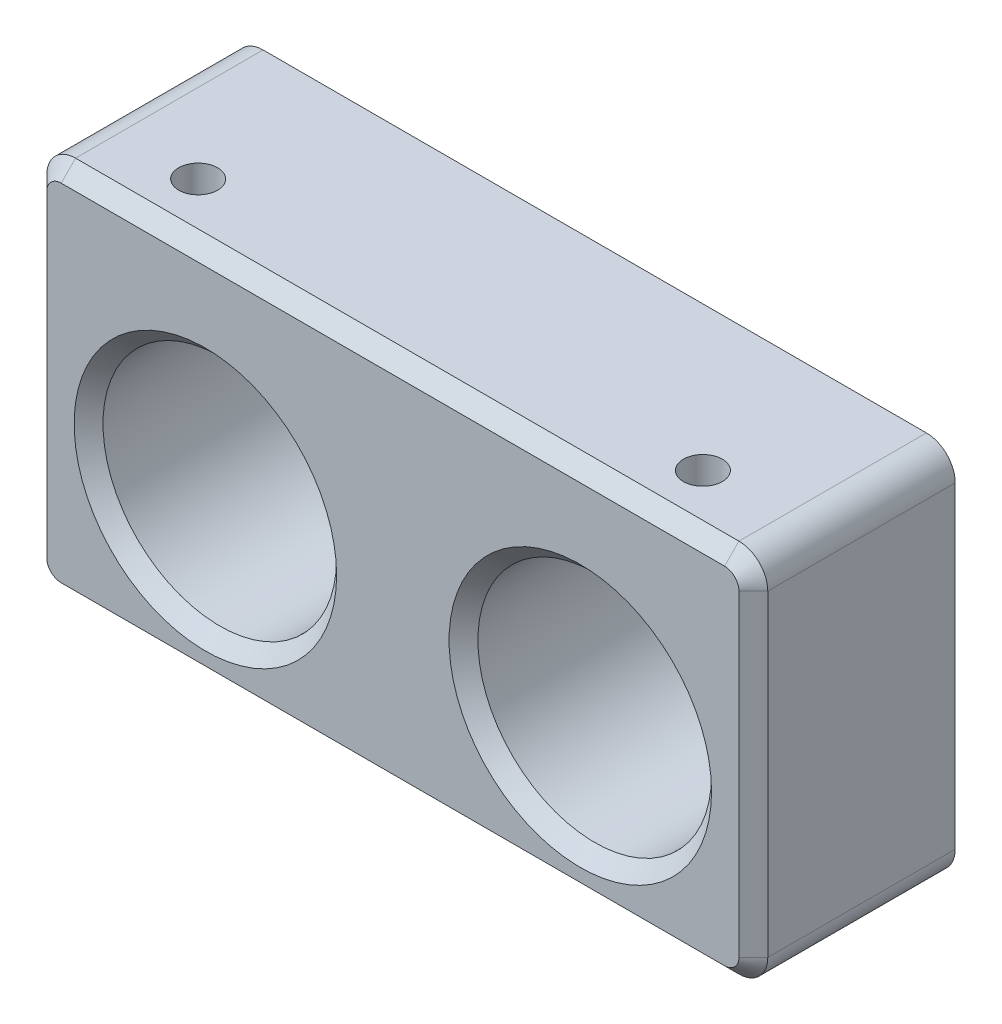
from build123d import *

# Parameters (mm, degrees)
SKETCH_1_W          = 50
SKETCH_1_H          = 26
SKETCH_1_R          = 8.1
EXTRUDE_1_DEPTH     = 14
SKETCH_2_R          = 1.35
CUT_EXTRUDE_1_DEPTH = 5
SKETCH_3_W          = 12
SKETCH_3_H          = 4
CUT_EXTRUDE_2_DEPTH = 4
CHAMFER_1_SIZE      = 1
FILLET_1_R          = 2
CHAMFER_2_SIZE      = 1


with BuildPart() as part:
    # 草图1 → 凸台-拉伸1 (new body)
    with BuildSketch(Plane.XY):
        with Locations((0, 2)):
            Rectangle(SKETCH_1_W, SKETCH_1_H)
        with Locations((13, 0)):
            Circle(SKETCH_1_R, mode=Mode.SUBTRACT)
        with Locations((-13, 0)):
            Circle(SKETCH_1_R, mode=Mode.SUBTRACT)
    extrude(amount=EXTRUDE_1_DEPTH)

    # 草图2 → 切除-拉伸1 (cut)
    with BuildSketch(Plane(origin=(0, 15, 0), x_dir=(1, 0, 0), z_dir=(0, 1, 0))):
        with Locations(Location((-17.5, -10, 0), (0, 0, 270))):
            Circle(SKETCH_2_R)
        with Locations(Location((17.5, -10, 0), (0, 0, 270))):
            Circle(SKETCH_2_R)
    extrude(amount=-CUT_EXTRUDE_1_DEPTH, mode=Mode.SUBTRACT)

    # 草图3 → 切除-拉伸2 (cut)
    with BuildSketch(Plane(origin=(0, 0, 0), x_dir=(-1, 0, 0), z_dir=(0, 0, -1))):
        with Locations((0, 9)):
            Rectangle(SKETCH_3_W, SKETCH_3_H)
        with BuildLine():
            Line((-6, -11), (6, -11))
            Line((6, -11), (6, -7))
            ThreePointArc((6, -7), (5.707106781, -6.292893219), (5, -6))
            Line((5, -6), (-5, -6))
            ThreePointArc((-5, -6), (-5.707106781, -6.292893219), (-6, -7))
            Line((-6, -7), (-6, -11))
        make_face()
    extrude(amount=-CUT_EXTRUDE_2_DEPTH, mode=Mode.SUBTRACT)

    # 倒角1
    chamfer_1_edges = [part.edges().sort_by_distance(p)[0] for p in [
        (-21.1, 0, 14),
        (4.9, 0, 14),
    ]]
    chamfer(chamfer_1_edges, length=CHAMFER_1_SIZE)

    # 圆角1
    fillet_1_edges = [part.edges().sort_by_distance(p)[0] for p in [
        (-25, 15, 7),
        (25, 15, 7),
        (25, -11, 7),
        (-25, -11, 7),
    ]]
    fillet(fillet_1_edges, radius=FILLET_1_R)

    # 倒角2
    chamfer_2_edges = [part.edges().sort_by_distance(p)[0] for p in [
        (-25, 2, 14),
        (0, 15, 14),
        (0, -11, 14),
        (25, 2, 14),
        (-24.414213562, -10.414213562, 14),
        (24.414213562, -10.414213562, 14),
        (24.414213562, 14.414213562, 14),
        (-24.414213562, 14.414213562, 14),
    ]]
    chamfer(chamfer_2_edges, length=CHAMFER_2_SIZE)


solid = part.part
